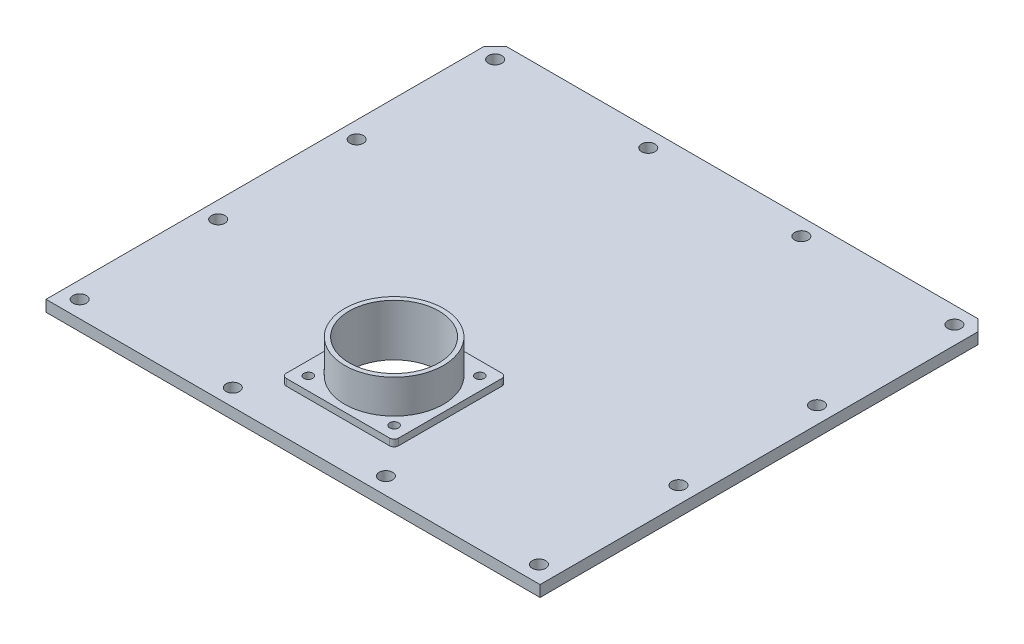
from build123d import *
from build123d.topology import SkipClean

# Parameters (mm, degrees)
SKETCH1_R           = 3
SKETCH1_R_2         = 20
BOSS_EXTRUDE1_DEPTH = 5
CHAMFER1_SIZE       = 5
BOSS_EXTRUDE3_DEPTH = 3
SKETCH3_R           = 22
SKETCH3_R_2         = 20
BOSS_EXTRUDE4_DEPTH = 15
FILLET2_R           = 2
BOSS_EXTRUDE5_DEPTH = 5
SKETCH6_R           = 20
CUT_EXTRUDE1_DEPTH  = 5
SKETCH7_R           = 2
CUT_EXTRUDE2_DEPTH  = 10
CHAMFER2_SIZE       = 2


with BuildPart() as part:
    # Sketch1 → Boss-Extrude1 (new body)
    with BuildSketch(Plane(origin=(0, 0, 0), x_dir=(1, 0, 0), z_dir=(0, 1, 0))):
        Polygon((110, -150), (110, 50), (0, 50), (-110, 50), (-110, -150), align=None)
        with Locations(Location((-102.5, 42.5, 0), (0, 0, 270))):
            Circle(SKETCH1_R, mode=Mode.SUBTRACT)
        with Locations(Location((-34.33, 42.5, 0), (0, 0, 270))):
            Circle(SKETCH1_R, mode=Mode.SUBTRACT)
        with Locations(Location((33.84, 42.5, 0), (0, 0, 270))):
            Circle(SKETCH1_R, mode=Mode.SUBTRACT)
        with Locations(Location((102.01, 42.5, 0), (0, 0, 270))):
            Circle(SKETCH1_R, mode=Mode.SUBTRACT)
        with Locations(Location((-34.33, -142.5, 0), (0, 0, 270))):
            Circle(SKETCH1_R, mode=Mode.SUBTRACT)
        with Locations(Location((33.84, -142.5, 0), (0, 0, 270))):
            Circle(SKETCH1_R, mode=Mode.SUBTRACT)
        with Locations(Location((102.01, -142.5, 0), (0, 0, 270))):
            Circle(SKETCH1_R, mode=Mode.SUBTRACT)
        with Locations(Location((-102.5, -142.5, 0), (0, 0, 270))):
            Circle(SKETCH1_R, mode=Mode.SUBTRACT)
        with Locations(Location((-102.5, -19.17, 0), (0, 0, 270))):
            Circle(SKETCH1_R, mode=Mode.SUBTRACT)
        with Locations(Location((-102.5, -80.84, 0), (0, 0, 270))):
            Circle(SKETCH1_R, mode=Mode.SUBTRACT)
        with Locations(Location((102.5, -19.17, 0), (0, 0, 270))):
            Circle(SKETCH1_R, mode=Mode.SUBTRACT)
        with Locations(Location((102.5, -80.84, 0), (0, 0, 270))):
            Circle(SKETCH1_R, mode=Mode.SUBTRACT)
        with Locations(Location((0, -105, 0), (0, 0, 270))):
            Circle(SKETCH1_R_2, mode=Mode.SUBTRACT)
    extrude(amount=BOSS_EXTRUDE1_DEPTH)

    # Chamfer1
    chamfer1_edges = [part.edges().sort_by_distance(p)[0] for p in [
        (110, 2.5, -50),
        (-110, 2.5, -50),
    ]]
    chamfer(chamfer1_edges, length=CHAMFER1_SIZE)

    # Sketch2 → Boss-Extrude3 (add)
    with BuildSketch(Plane(origin=(0, 5, 0), x_dir=(1, 0, 0), z_dir=(0, 1, 0))):
        Polygon((0, -130), (-25, -130), (-25, -80), (25, -80), (25, -130), align=None)
    extrude(amount=BOSS_EXTRUDE3_DEPTH)

    # Sketch3 → Boss-Extrude4 (add)
    with BuildSketch(Plane(origin=(0, 8, 0), x_dir=(1, 0, 0), z_dir=(0, 1, 0))):
        with Locations(Location((0, -105, 0), (0, 0, 90))):
            Circle(SKETCH3_R)
        with Locations(Location((0, -105, 0), (0, 0, 90))):
            Circle(SKETCH3_R_2, mode=Mode.SUBTRACT)
    extrude(amount=BOSS_EXTRUDE4_DEPTH)

    # Fillet2
    fillet2_edges = [part.edges().sort_by_distance(p)[0] for p in [
        (-25, 6.5, 80),
        (-25, 6.5, 130),
        (25, 6.5, 130),
        (25, 6.5, 80),
    ]]
    fillet(fillet2_edges, radius=FILLET2_R)

    # Sketch4 → Boss-Extrude5 (add)
    with BuildSketch(Plane.XZ):
        Polygon((95, 135), (0, 135), (-95, 135), (-95, -35), (95, -35), align=None)
        Polygon((-90, 130), (0, 130), (90, 130), (90, -30), (-90, -30), align=None, mode=Mode.SUBTRACT)
    extrude(amount=BOSS_EXTRUDE5_DEPTH)

    # Sketch6 → Cut-Extrude1 (cut)
    with SkipClean():  # the faces are left unmerged after this step: merging them gives an invalid solid
        with BuildSketch(Plane.XZ.offset(-5)):
            with Locations(Location((0, 105, 0), (0, 0, 90))):
                Circle(SKETCH6_R)
        extrude(amount=-CUT_EXTRUDE1_DEPTH, mode=Mode.SUBTRACT)

    # Sketch7 → Cut-Extrude2 (cut)
    with BuildSketch(Plane(origin=(0, 8, 0), x_dir=(1, 0, 0), z_dir=(0, 1, 0))):
        with Locations(Location((19.091883092, -124.091883092, 0), (0, 0, 270))):
            Circle(SKETCH7_R)
        with Locations(Location((-19.091883092, -124.091883092, 0), (0, 0, 270))):
            Circle(SKETCH7_R)
        with Locations(Location((-19.091883092, -85.908116908, 0), (0, 0, 270))):
            Circle(SKETCH7_R)
        with Locations(Location((19.091883092, -85.908116908, 0), (0, 0, 270))):
            Circle(SKETCH7_R)
    extrude(amount=-CUT_EXTRUDE2_DEPTH, mode=Mode.SUBTRACT)

    # Chamfer2
    chamfer2_edges = [part.edges().sort_by_distance(p)[0] for p in [
        (0, -5, 135),
        (-95, -5, 50),
        (0, -5, -35),
        (95, -5, 50),
    ]]
    chamfer(chamfer2_edges, length=CHAMFER2_SIZE)


solid = part.part
